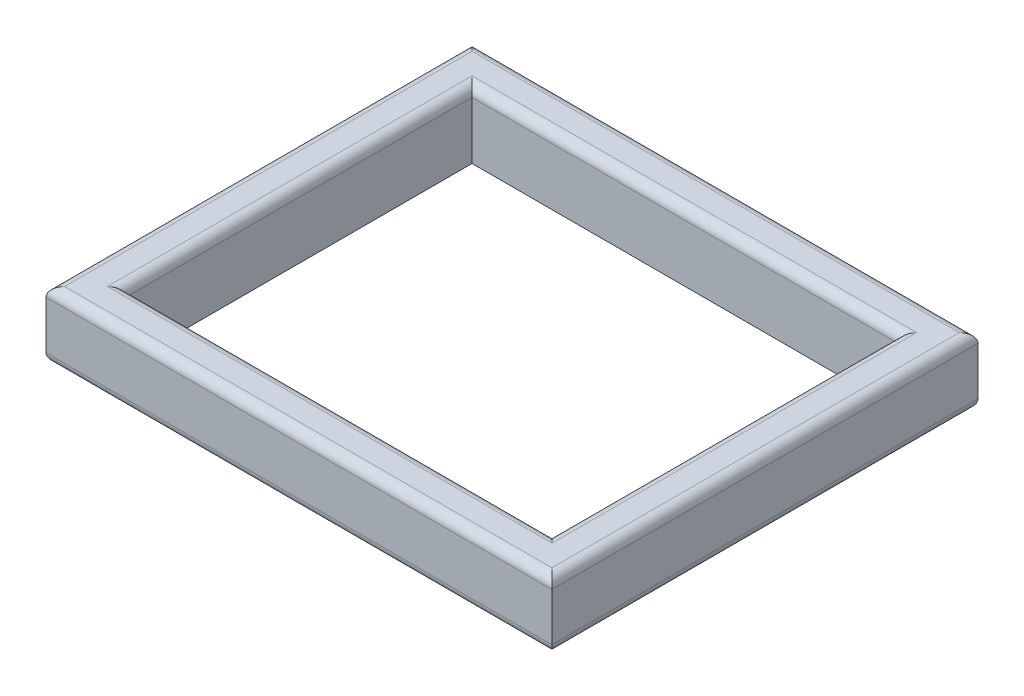
from build123d import *

# Parameters (mm, degrees)
SKETCH1_W           = 965.2
SKETCH1_H           = 812.8
SKETCH1_W_2         = 812.8
SKETCH1_H_2         = 660.4
BOSS_EXTRUDE1_DEPTH = 127
FILLET1_R           = 17.78


with BuildPart() as part:
    # Sketch1 → Boss-Extrude1 (new body)
    with BuildSketch(Plane(origin=(0, 0, 0), x_dir=(1, 0, 0), z_dir=(0, 1, 0))):
        Rectangle(SKETCH1_W, SKETCH1_H)
        Rectangle(SKETCH1_W_2, SKETCH1_H_2, mode=Mode.SUBTRACT)
    extrude(amount=BOSS_EXTRUDE1_DEPTH)

    # Fillet1
    fillet1_edges = [part.edges().sort_by_distance(p)[0] for p in [
        (482.6, 127, 0),
        (406.4, 127, 0),
        (0, 127, -406.4),
        (0, 127, -330.2),
        (-406.4, 127, 0),
        (0, 127, 330.2),
        (-482.6, 127, 0),
        (0, 0, -406.4),
        (482.6, 0, 0),
        (0, 0, 406.4),
        (-482.6, 0, 0),
        (0, 127, 406.4),
    ]]
    fillet(fillet1_edges, radius=FILLET1_R)


solid = part.part
